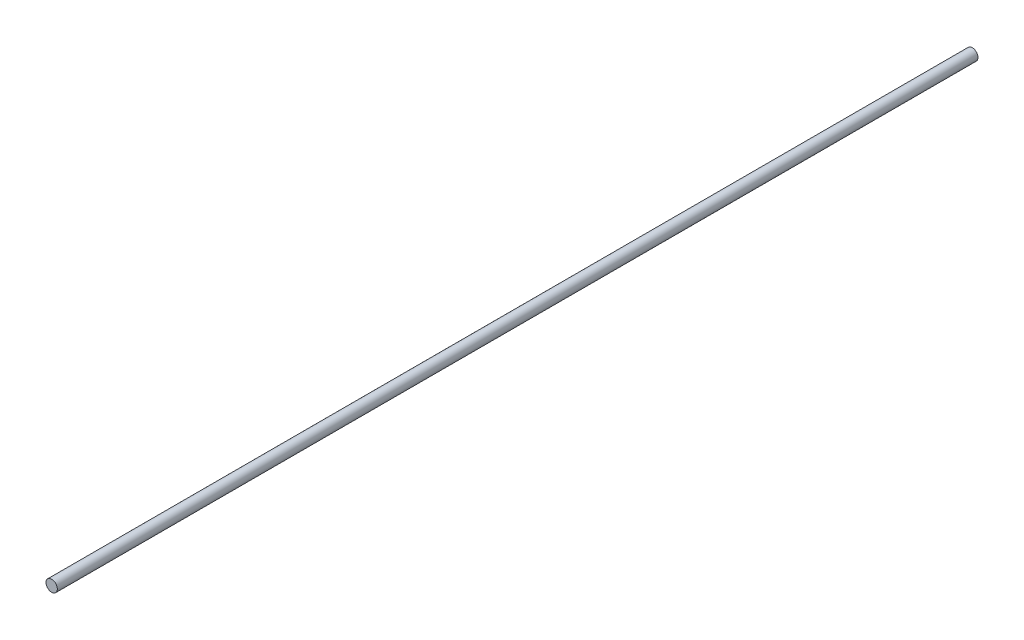
from build123d import *

# Parameters (mm, degrees)
ESTRUSIONE_ESTRUSIONE1_DEPTH      = 162
ESTRUSIONE_ESTRUSIONE1_DEPTH_BACK = 162
SCHIZZO1_R                        = 2


with BuildPart() as part:
    # Schizzo1 → Estrusione-Estrusione1 (new, two sides: drawn at the far end of the back side and taken through both)
    with BuildSketch(Plane.XY.offset(-ESTRUSIONE_ESTRUSIONE1_DEPTH_BACK)):
        Circle(SCHIZZO1_R)
    extrude(amount=ESTRUSIONE_ESTRUSIONE1_DEPTH + ESTRUSIONE_ESTRUSIONE1_DEPTH_BACK)


solid = part.part
